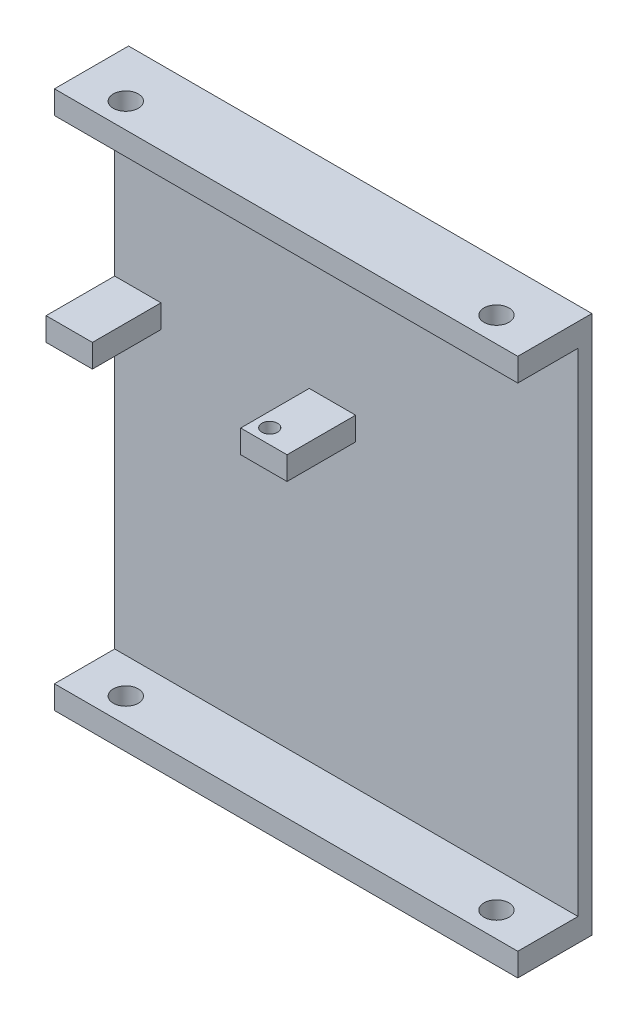
from build123d import *

# Parameters (mm, degrees)
SKETCH1_W           = 127
SKETCH1_H           = 147.574
BOSS_EXTRUDE1_DEPTH = 3.81
SKETCH3_W           = 127
SKETCH3_H           = 6.35
BOSS_EXTRUDE2_DEPTH = 16.51
SKETCH4_R           = 3.429
CUT_EXTRUDE1_DEPTH  = 196.754917885
SKETCH6_W           = 12.7
SKETCH6_H           = 6.35
BOSS_EXTRUDE3_DEPTH = 18.796
CUT_EXTRUDE4_DEPTH  = 6.35


with BuildPart() as part:
    # Sketch1 → Boss-Extrude1 (new body)
    with BuildSketch(Plane.XY):
        with Locations((63.5, 73.787)):
            Rectangle(SKETCH1_W, SKETCH1_H)
    extrude(amount=BOSS_EXTRUDE1_DEPTH)

    # Sketch3 → Boss-Extrude2 (add)
    with BuildSketch(Plane.XY.offset(3.81)):
        with Locations((63.5, 144.399)):
            Rectangle(SKETCH3_W, SKETCH3_H)
        with Locations((63.5, 3.175)):
            Rectangle(SKETCH3_W, SKETCH3_H)
    extrude(amount=BOSS_EXTRUDE2_DEPTH)

    # Sketch4 → Cut-Extrude1 (cut, through all)
    with BuildSketch(Plane.XZ):
        with Locations(Location((12.7, 13.462, 0), (0, 0, 270))):
            Circle(SKETCH4_R)
        with Locations(Location((114.3, 13.462, 0), (0, 0, 270))):
            Circle(SKETCH4_R)
    extrude(amount=-CUT_EXTRUDE1_DEPTH, mode=Mode.SUBTRACT)

    # Sketch6 → Boss-Extrude3 (add)
    with BuildSketch(Plane.XY.offset(3.81)):
        with Locations((6.35, 91.694)):
            Rectangle(SKETCH6_W, SKETCH6_H)
        with Locations((59.69, 91.694)):
            Rectangle(SKETCH6_W, SKETCH6_H)
    extrude(amount=BOSS_EXTRUDE3_DEPTH)

    # Sketch10 → Cut-Extrude4 (cut)
    with BuildSketch(Plane.XZ.offset(-88.519)):
        with BuildLine():
            ThreePointArc((59.2, 17.66), (59.397338077, 18.539315257), (59.2169552, 19.422264664))
            ThreePointArc((59.2169552, 19.422264664), (59.208568363, 19.441173113), (59.2, 19.46))
            ThreePointArc((59.2, 19.46), (55.097437581, 18.56), (59.2, 17.66))
        make_face()
    extrude(amount=-CUT_EXTRUDE4_DEPTH, mode=Mode.SUBTRACT)


solid = part.part
